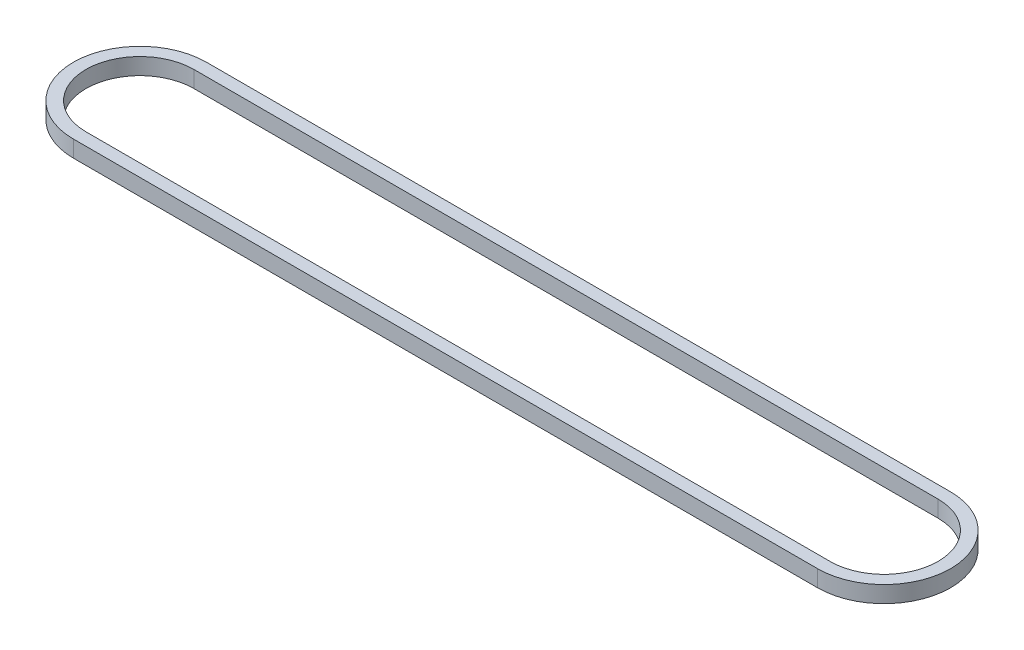
from build123d import *

# Parameters (mm, degrees)
BOSS_EXTRUDE1_DEPTH = 7.7978


with BuildPart() as part:
    # Sketch1 → Boss-Extrude1 (new body)
    with BuildSketch(Plane(origin=(0, 0, 0), x_dir=(1, 0, 0), z_dir=(0, 1, 0))):
        with BuildLine():
            Line((-175, 31.28695), (175, 31.28695))
            ThreePointArc((175, 31.28695), (206.28695, 0), (175, -31.28695))
            Line((175, -31.28695), (-175, -31.28695))
            ThreePointArc((-175, -31.28695), (-206.28695, 0), (-175, 31.28695))
        make_face()
        with BuildLine():
            Line((-175, 25.39415), (175, 25.39415))
            ThreePointArc((175, 25.39415), (200.39415, 0), (175, -25.39415))
            Line((175, -25.39415), (-175, -25.39415))
            ThreePointArc((-175, -25.39415), (-200.39415, 0), (-175, 25.39415))
        make_face(mode=Mode.SUBTRACT)
    extrude(amount=BOSS_EXTRUDE1_DEPTH)


solid = part.part
